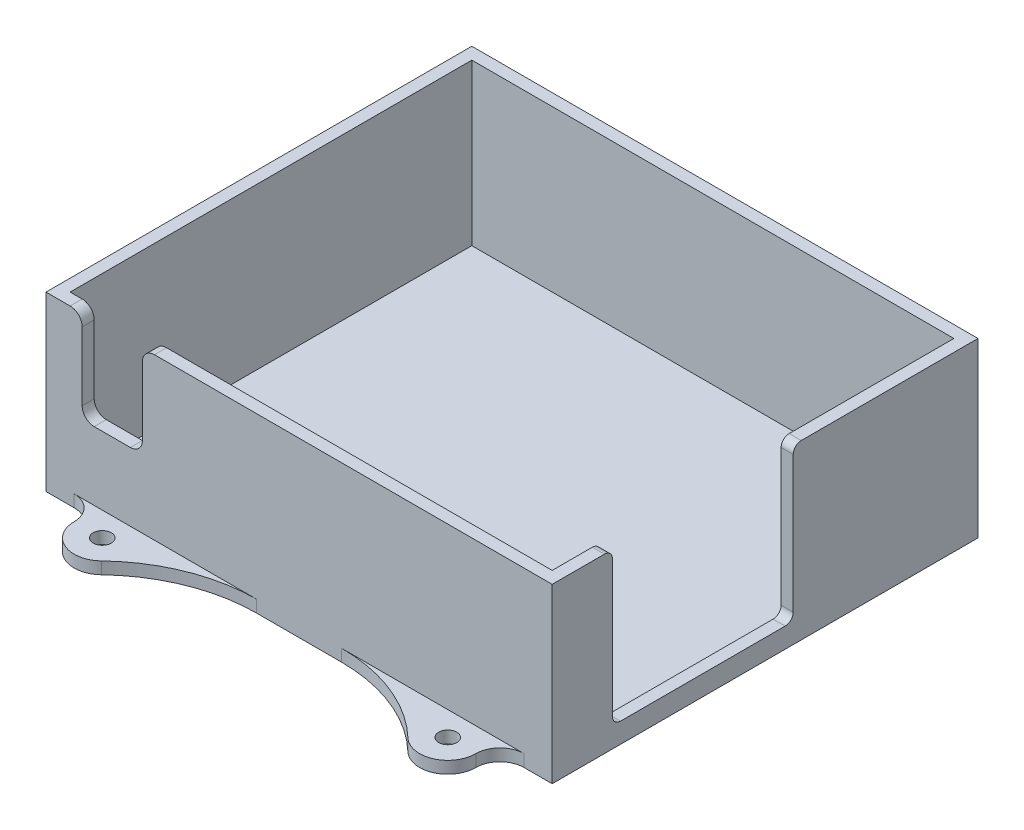
from build123d import *

# Parameters (mm, degrees)
SKETCH1_W           = 126
SKETCH1_H           = 106
SKETCH1_W_2         = 120
SKETCH1_H_2         = 100
BOSS_EXTRUDE1_DEPTH = 40
SKETCH2_R           = 2.25
BOSS_EXTRUDE2_DEPTH = 3
SKETCH3_W           = 15
SKETCH3_H           = 23
CUT_EXTRUDE1_DEPTH  = 3
FILLET1_R           = 3
SKETCH4_W           = 45
SKETCH4_H           = 38
CUT_EXTRUDE2_DEPTH  = 3
FILLET2_R           = 2


with BuildPart() as part:
    # Sketch1 → Boss-Extrude1 (new body)
    with BuildSketch(Plane(origin=(0, 0, 0), x_dir=(1, 0, 0), z_dir=(0, 1, 0))):
        Rectangle(SKETCH1_W, SKETCH1_H)
        Rectangle(SKETCH1_W_2, SKETCH1_H_2, mode=Mode.SUBTRACT)
    extrude(amount=BOSS_EXTRUDE1_DEPTH)

    # Sketch2 → Boss-Extrude2 (add)
    with BuildSketch(Plane.XZ):
        with BuildLine():
            Line((56, 53), (63, 53))
            Line((63, 53), (63, -53))
            Line((63, -53), (56, -53))
            ThreePointArc((56, -53), (51.757359313, -54.757359313), (50, -59))
            ThreePointArc((50, -59), (45.754014261, -65.435480204), (38.167027014, -64.063829787))
            ThreePointArc((38.167027014, -64.063829787), (25.425407281, -55.868835135), (10.550038521, -53))
            Line((10.550038521, -53), (-10.550038521, -53))
            ThreePointArc((-10.550038521, -53), (-25.425407281, -55.868835135), (-38.167027014, -64.063829787))
            ThreePointArc((-38.167027014, -64.063829787), (-45.754014261, -65.435480204), (-50, -59))
            ThreePointArc((-50, -59), (-51.757359313, -54.757359313), (-56, -53))
            Line((-56, -53), (-63, -53))
            Line((-63, -53), (-63, 53))
            Line((-63, 53), (-56, 53))
            ThreePointArc((-56, 53), (-51.757359313, 54.757359313), (-50, 59))
            ThreePointArc((-50, 59), (-45.754014261, 65.435480204), (-38.167027014, 64.063829787))
            ThreePointArc((-38.167027014, 64.063829787), (-25.425407281, 55.868835135), (-10.550038521, 53))
            Line((-10.550038521, 53), (10.550038521, 53))
            ThreePointArc((10.550038521, 53), (25.425407281, 55.868835135), (38.167027014, 64.063829787))
            ThreePointArc((38.167027014, 64.063829787), (45.754014261, 65.435480204), (50, 59))
            ThreePointArc((50, 59), (51.757359313, 54.757359313), (56, 53))
        make_face()
        with Locations(Location((43, 59, 0), (0, 0, 270))):
            Circle(SKETCH2_R, mode=Mode.SUBTRACT)
        with Locations(Location((43, -59, 0), (0, 0, 90))):
            Circle(SKETCH2_R, mode=Mode.SUBTRACT)
        with Locations(Location((-43, -59, 0), (0, 0, 270))):
            Circle(SKETCH2_R, mode=Mode.SUBTRACT)
        with Locations(Location((-43, 59, 0), (0, 0, 90))):
            Circle(SKETCH2_R, mode=Mode.SUBTRACT)
    extrude(amount=BOSS_EXTRUDE2_DEPTH)

    # Sketch3 → Cut-Extrude1 (cut)
    with BuildSketch(Plane.XY.offset(53)):
        with Locations((-46.5, 28.5)):
            Rectangle(SKETCH3_W, SKETCH3_H)
    extrude(amount=-CUT_EXTRUDE1_DEPTH, mode=Mode.SUBTRACT)

    # Fillet1
    fillet1_edges = [part.edges().sort_by_distance(p)[0] for p in [
        (-54, 17, 51.5),
        (-54, 40, 51.5),
        (-39, 40, 51.5),
        (-39, 17, 51.5),
    ]]
    fillet(fillet1_edges, radius=FILLET1_R)

    # Sketch4 → Cut-Extrude2 (cut)
    with BuildSketch(Plane(origin=(63, 0, 0), x_dir=(0, 0, -1), z_dir=(1, 0, 0))):
        with Locations((-15.5, 21)):
            Rectangle(SKETCH4_W, SKETCH4_H)
    extrude(amount=-CUT_EXTRUDE2_DEPTH, mode=Mode.SUBTRACT)

    # Fillet2
    fillet2_edges = [part.edges().sort_by_distance(p)[0] for p in [
        (61.5, 2, 38),
        (61.5, 40, 38),
        (61.5, 40, -7),
        (61.5, 2, -7),
    ]]
    fillet(fillet2_edges, radius=FILLET2_R)


solid = part.part
